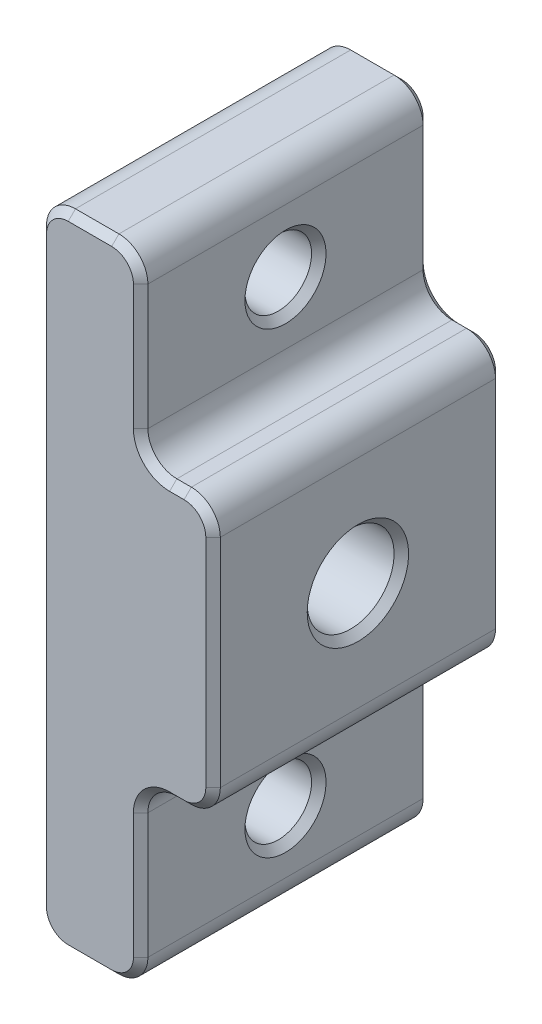
from build123d import *

# Parameters (mm, degrees)
AUFSATZ_LINEAR_AUSTRAGEN1_DEPTH = 20
SKIZZE2_R                       = 3
SCHNITT_LINEAR_AUSTRAGEN1_DEPTH = 20
SKIZZE3_R                       = 5.25
SCHNITT_LINEAR_AUSTRAGEN2_DEPTH = 6.55
SKIZZE4_R                       = 2.3
SCHNITT_LINEAR_AUSTRAGEN3_DEPTH = 10
VERRUNDUNG1_R                   = 2
FASE1_SIZE                      = 0.5


with BuildPart() as part:
    # Skizze1 → Aufsatz-Linear austragen1 (new body)
    with BuildSketch(Plane.XY):
        Polygon((0, -22.130332374), (0, 22.130332374), (7, 22.130332374), (7, 9.485781443), (12, 9.485781443), (12, -9.485781443), (7, -9.485781443), (7, -22.130332374), align=None)
    extrude(amount=AUFSATZ_LINEAR_AUSTRAGEN1_DEPTH)

    # Skizze2 → Schnitt-Linear austragen1 (cut)
    with BuildSketch(Plane(origin=(12, 0, 0), x_dir=(0, 0, -1), z_dir=(1, 0, 0))):
        with Locations((-10, 0)):
            Circle(SKIZZE2_R)
    extrude(amount=-SCHNITT_LINEAR_AUSTRAGEN1_DEPTH, mode=Mode.SUBTRACT)

    # Skizze3 → Schnitt-Linear austragen2 (cut)
    with BuildSketch(Plane.ZY):
        with Locations((10, 0)):
            Circle(SKIZZE3_R)
    extrude(amount=-SCHNITT_LINEAR_AUSTRAGEN2_DEPTH, mode=Mode.SUBTRACT)

    # Skizze4 → Schnitt-Linear austragen3 (cut)
    with BuildSketch(Plane(origin=(7, 0, 0), x_dir=(0, 0, -1), z_dir=(1, 0, 0))):
        with Locations((-10, -15.808056909)):
            Circle(SKIZZE4_R)
        with Locations((-10, 15.808056909)):
            Circle(SKIZZE4_R)
    extrude(amount=-SCHNITT_LINEAR_AUSTRAGEN3_DEPTH, mode=Mode.SUBTRACT)

    # Verrundung1
    verrundung1_edges = [part.edges().sort_by_distance(p)[0] for p in [
        (7, -9.485781443, 10),
        (7, -22.130332374, 10),
        (0, -22.130332374, 10),
        (0, 22.130332374, 10),
        (7, 22.130332374, 10),
        (7, 9.485781443, 10),
        (12, 9.485781443, 10),
        (12, -9.485781443, 10),
    ]]
    fillet(verrundung1_edges, radius=VERRUNDUNG1_R)

    # Fase1
    fase1_edges = [part.edges().sort_by_distance(p)[0] for p in [
        (12, 0, 13),
        (0, 0, 4.75),
        (6.55, 0, 13),
        (0, -15.808056909, 12.3),
        (7, -15.808056909, 12.3),
        (0, 15.808056909, 12.3),
        (7, 15.808056909, 12.3),
        (0, 0, 0),
        (0, 0, 20),
        (9.5, -9.485781443, 0),
        (7, -15.808056909, 0),
        (3.5, -22.130332374, 0),
        (3.5, 22.130332374, 0),
        (7, 15.808056909, 0),
        (9.5, 9.485781443, 0),
        (12, 0, 0),
        (0.585786438, -21.544545937, 0),
        (6.414213562, -21.544545937, 0),
        (11.414213562, -8.899995006, 0),
        (11.414213562, 8.899995006, 0),
        (6.414213562, 21.544545937, 0),
        (0.585786438, 21.544545937, 0),
        (3.5, 22.130332374, 20),
        (9.5, -9.485781443, 20),
        (12, 0, 20),
        (9.5, 9.485781443, 20),
        (7, 15.808056909, 20),
        (3.5, -22.130332374, 20),
        (7, -15.808056909, 20),
        (0.585786438, -21.544545937, 20),
        (6.414213562, -21.544545937, 20),
        (11.414213562, -8.899995006, 20),
        (11.414213562, 8.899995006, 20),
        (6.414213562, 21.544545937, 20),
        (0.585786438, 21.544545937, 20),
        (7.585786438, -10.071567881, 0),
        (7.585786438, -10.071567881, 20),
        (7.585786438, 10.071567881, 0),
        (7.585786438, 10.071567881, 20),
    ]]
    chamfer(fase1_edges, length=FASE1_SIZE)


solid = part.part
